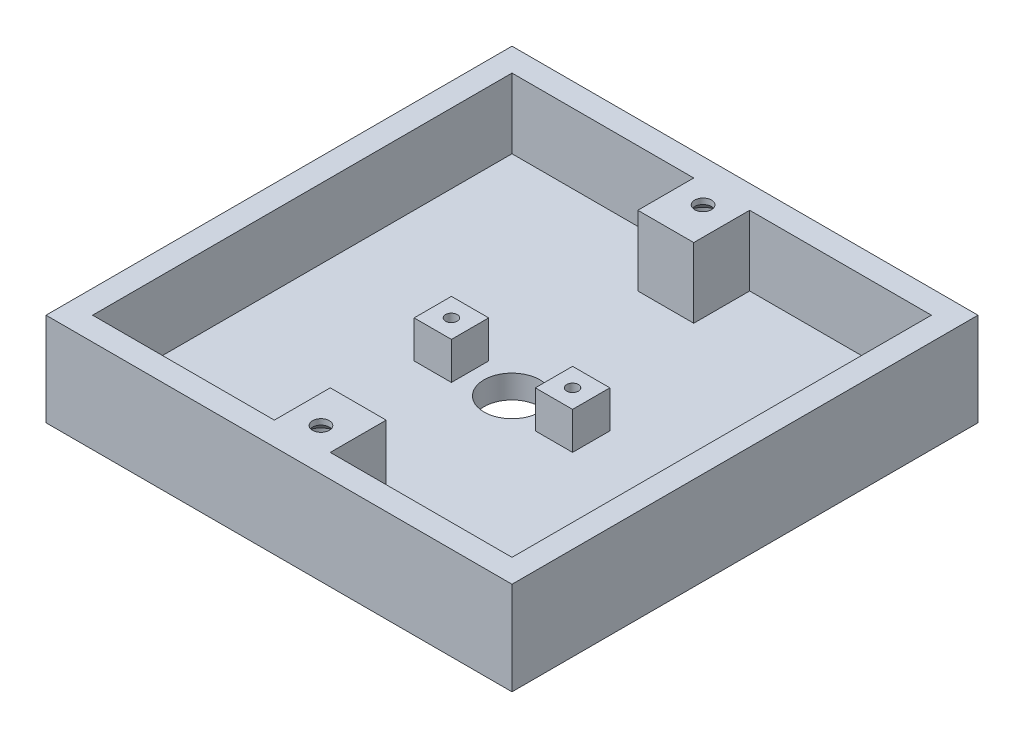
from build123d import *

# Parameters (mm, degrees)
SKETCH1_W           = 50
SKETCH1_H           = 50
BOSS_EXTRUDE1_DEPTH = 10
SHELL1_T            = -2.5
SKETCH5_W           = 6
SKETCH5_H           = 6
BOSS_EXTRUDE3_DEPTH = 7.5
SKETCH9_R           = 3
CUT_EXTRUDE1_DEPTH  = 37.742346142
SKETCH15_W          = 4
SKETCH15_H          = 4
BOSS_EXTRUDE5_DEPTH = 4
M1_6_TAPPED_HOLE2_D = 1.25


with BuildPart() as part:
    # Sketch1 → Boss-Extrude1 (new body)
    with BuildSketch(Plane(origin=(0, 0, 0), x_dir=(1, 0, 0), z_dir=(0, 1, 0))):
        Rectangle(SKETCH1_W, SKETCH1_H)
    extrude(amount=BOSS_EXTRUDE1_DEPTH)

    # Shell1
    shell1_openings = [part.faces().sort_by_distance(p)[0] for p in [
        (0, 10, 0),
    ]]
    offset(amount=SHELL1_T, openings=shell1_openings, kind=Kind.INTERSECTION)

    # Sketch5 → Boss-Extrude3 (add)
    with BuildSketch(Plane(origin=(0, 2.5, 0), x_dir=(1, 0, 0), z_dir=(0, 1, 0))):
        with Locations((0, -19.5)):
            Rectangle(SKETCH5_W, SKETCH5_H)
    boss_extrude3 = extrude(amount=BOSS_EXTRUDE3_DEPTH)

    # Sketch8 → CSK SLOT for M1.6 Countersunk Flat Head Screw1 (revolve, cut)
    with BuildSketch(Plane(origin=(0, 0, 20.5), x_dir=(0, 0, -1), z_dir=(1, 0, 0))):
        Polygon((0, 0), (0, 10), (0.9, 10), (0.9, 9.4), (1.8, 8.5), (1.8, 0), align=None)
    csk_slot_for_m1_6_countersunk_flat_head = revolve(axis=Axis((0, -6.35, 20.5), (0, 1, 0)), mode=Mode.SUBTRACT)

    # Mirror1: Boss-Extrude3, CSK SLOT for M1.6 Countersunk Flat Head Screw1 across plane
    add(boss_extrude3.mirror(Plane.XY))
    add(csk_slot_for_m1_6_countersunk_flat_head.mirror(Plane.XY), mode=Mode.SUBTRACT)

    # Sketch9 → Cut-Extrude1 (cut, through all)
    with BuildSketch(Plane.XZ):
        with Locations(Location((0, 0, 0), (0, 0, 270))):
            Circle(SKETCH9_R)
    extrude(amount=-CUT_EXTRUDE1_DEPTH, mode=Mode.SUBTRACT)

    # Sketch15 → Boss-Extrude5 (add)
    with BuildSketch(Plane(origin=(0, 2.5, 0), x_dir=(1, 0, 0), z_dir=(0, 1, 0))):
        with Locations((-6.5, 0)):
            Rectangle(SKETCH15_W, SKETCH15_H)
        with Locations((6.5, 0)):
            Rectangle(SKETCH15_W, SKETCH15_H)
    extrude(amount=BOSS_EXTRUDE5_DEPTH)

    # M1.6 Tapped Hole2 (through all)
    with Locations(Plane(origin=(0, 0, 0), x_dir=(-1, 0, 0), z_dir=(0, -1, 0))):
        with Locations((-6.5, 0), (6.5, 0)):
            Hole(M1_6_TAPPED_HOLE2_D / 2)


solid = part.part
